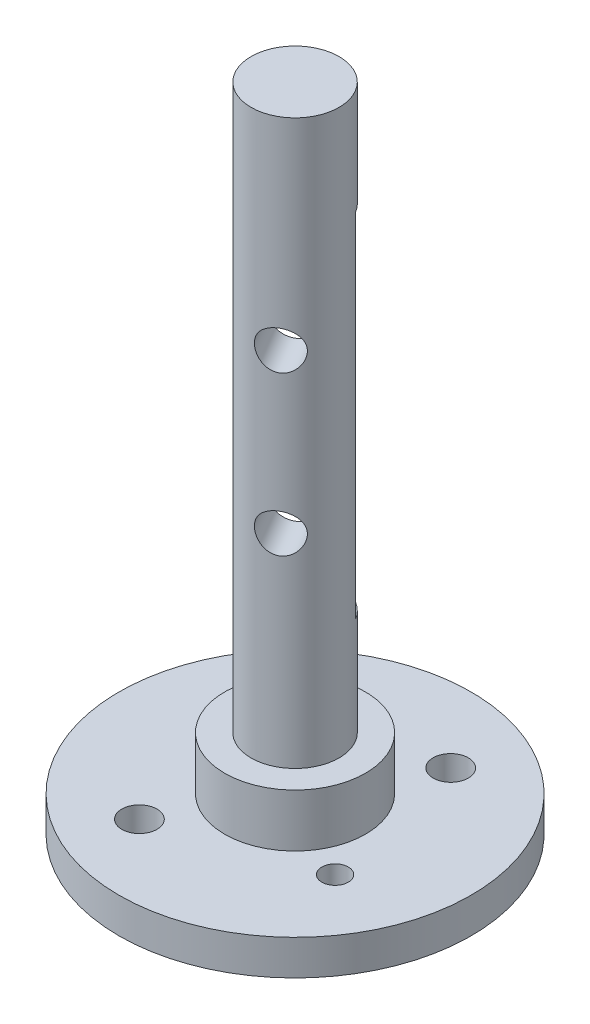
from build123d import *

# Parameters (mm, degrees)
SKETCH_1_R          = 10
EXTRUDE_1_DEPTH     = 2
SKETCH_2_R          = 2.5
EXTRUDE_2_DEPTH     = 35
SKETCH_3_R          = 1
SKETCH_3_R_2        = 0.75
CUT_EXTRUDE_1_DEPTH = 3
SKETCH_4_R          = 3.5
CUT_EXTRUDE_2_DEPTH = 1
SKETCH_6_R          = 4
EXTRUDE_4_DEPTH     = 3
CUT_EXTRUDE_START   = -26
CUT_EXTRUDE_3_DEPTH = 20
SKETCH_12_R         = 1.1
CUT_EXTRUDE_6_DEPTH = 3


with BuildPart() as part:
    # 草图1 → 凸台-拉伸1 (new body)
    with BuildSketch(Plane(origin=(0, 0, 0), x_dir=(1, 0, 0), z_dir=(0, 1, 0))):
        with Locations(Location((0, 0, 0), (0, 0, 270))):
            Circle(SKETCH_1_R)
    extrude(amount=EXTRUDE_1_DEPTH)

    # 草图2 → 凸台-拉伸2 (add)
    with BuildSketch(Plane(origin=(0, 2, 0), x_dir=(1, 0, 0), z_dir=(0, 1, 0))):
        with Locations(Location((0, 0, 0), (0, 0, 270))):
            Circle(SKETCH_2_R)
    extrude(amount=EXTRUDE_2_DEPTH)

    # 草图3 → 切除-拉伸1 (cut)
    with BuildSketch(Plane.XZ):
        with Locations(Location((-3.15926406, 5.68058541, 0), (0, 0, 270))):
            Circle(SKETCH_3_R)
        with Locations(Location((3.15926406, -5.68058541, 0), (0, 0, 90))):
            Circle(SKETCH_3_R)
        with Locations(Location((5.121266231, 2.84819806, 0), (0, 0, 270))):
            Circle(SKETCH_3_R_2)
        with Locations(Location((-5.121266231, -2.84819806, 0), (0, 0, 90))):
            Circle(SKETCH_3_R_2)
    extrude(amount=-CUT_EXTRUDE_1_DEPTH, mode=Mode.SUBTRACT)

    # 草图4 → 切除-拉伸2 (cut)
    with BuildSketch(Plane.XZ):
        with Locations(Location((0, 0, 0), (0, 0, 270))):
            Circle(SKETCH_4_R)
    extrude(amount=-CUT_EXTRUDE_2_DEPTH, mode=Mode.SUBTRACT)

    # 草图6 → 凸台-拉伸4 (add)
    with BuildSketch(Plane(origin=(0, 2, 0), x_dir=(1, 0, 0), z_dir=(0, 1, 0))):
        with Locations(Location((0, 0, 0), (0, 0, 270))):
            Circle(SKETCH_6_R)
    extrude(amount=EXTRUDE_4_DEPTH)

    # 草图7 → 切除-拉伸3 (cut)
    with BuildSketch(Plane(origin=(0, 37, 0), x_dir=(1, 0, 0), z_dir=(0, 1, 0)).offset(CUT_EXTRUDE_START)):
        with BuildLine():
            Line((2.157730635, 1.26261574), (-2.157730635, -1.26261574))
            ThreePointArc((-2.157730635, -1.26261574), (-1.26261574, 2.157730635), (2.157730635, 1.26261574))
        make_face()
    extrude(amount=CUT_EXTRUDE_3_DEPTH, mode=Mode.SUBTRACT)

    # 草图12 → 切除-拉伸6 (cut)
    with BuildSketch(Plane(origin=(0, 0, 0), x_dir=(-0.8630922540018389, 0, 0.5050462959789186), z_dir=(-0.5050462959789186, 0, -0.8630922540018389))):
        with Locations((0, 16.5)):
            Circle(SKETCH_12_R)
    cut_extrude_6 = extrude(amount=-CUT_EXTRUDE_6_DEPTH, mode=Mode.SUBTRACT)

    # 镜向1: 切除-拉伸6 across plane
    add(cut_extrude_6.mirror(Plane.ZX.offset(21)), mode=Mode.SUBTRACT)


solid = part.part
